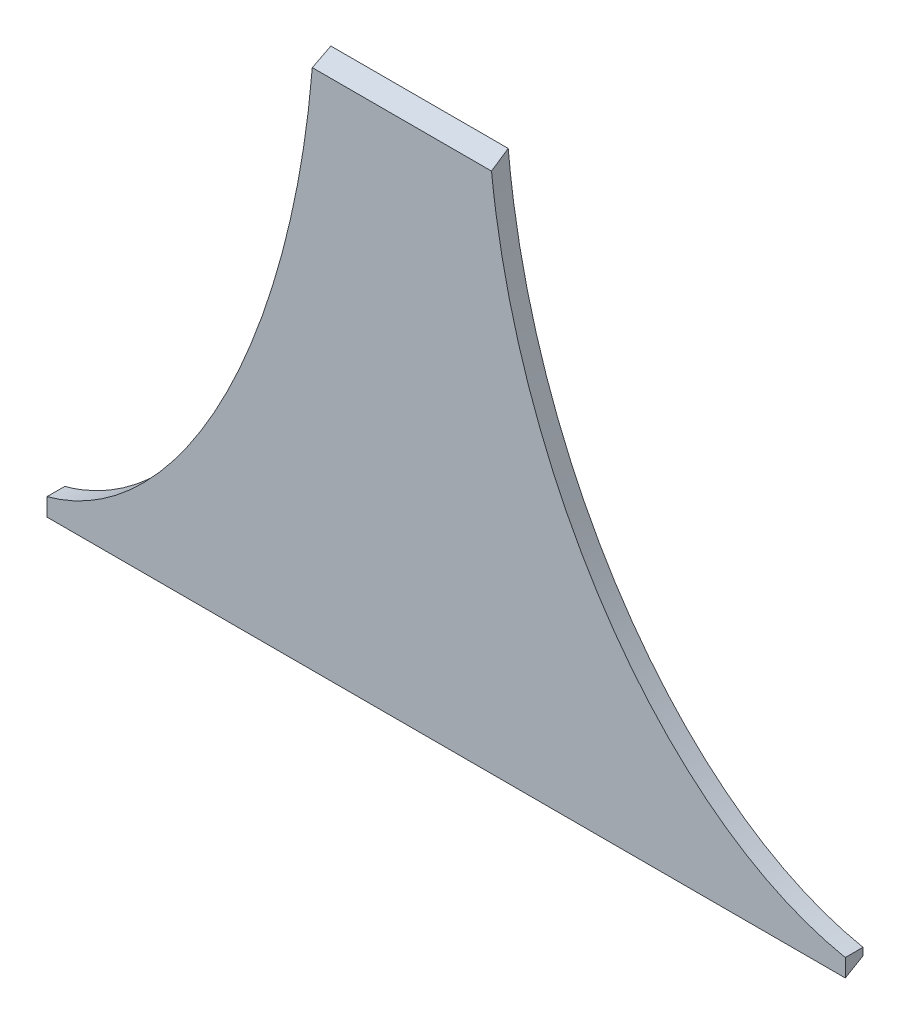
from build123d import *

# Parameters (mm, degrees)
BOSS_EXTRUDE1_DEPTH = 2.54
CUT_EXTRUDE3_REACH  = 139.395
CUT_EXTRUDE4_DEPTH  = 77.978


with BuildPart() as part:
    # Sketch1 → Boss-Extrude1 (new body)
    with BuildSketch(Plane.XY):
        with BuildLine():
            Line((0, 0), (-114.3, 0))
            Line((-114.3, 0), (-114.3, 2.54))
            add(Edge.make_bspline(
                [(-114.3, 2.54), (-80.840252574, 11.511154975), (-76.2, 76.2)],
                knots=[0.188439876, 0.188439876, 0.188439876, 1.620106138, 1.620106138, 1.620106138], degree=2, weights=[1, 0.754546764, 1]))
            Line((-76.2, 76.2), (-50.8, 76.2))
            add(Edge.make_bspline(
                [(-50.8, 76.2), (-44.726222493, 11.346977385), (0, 2.54)],
                knots=[4.596431231, 4.596431231, 4.596431231, 6.031007642, 6.031007642, 6.031007642], degree=2, weights=[1, 0.753591079, 1]))
            Line((0, 2.54), (0, 0))
        make_face()
    extrude(amount=BOSS_EXTRUDE1_DEPTH)

    # Sketch4 → Cut-Extrude3 (cut, up to next)
    with BuildSketch(Plane.ZY.offset(114.3), mode=Mode.PRIVATE) as cut_extrude3_sk1:
        Polygon((2.54, 0), (0, 1.466469684), (0, 0), align=None)
    cut_extrude3_tool1 = extrude(cut_extrude3_sk1.sketch, amount=-CUT_EXTRUDE3_REACH, mode=Mode.PRIVATE) & part.part
    add(cut_extrude3_tool1.solids().sort_by_distance((-114.3, 0.488823, 0.846667))[0], mode=Mode.SUBTRACT)

    # Sketch5 → Cut-Extrude4 (cut)
    with BuildSketch(Plane.ZY.offset(114.3)):
        Polygon((0, 76.2), (2.54, 74.733530316), (2.54, 76.2), align=None)
    extrude(amount=-CUT_EXTRUDE4_DEPTH, mode=Mode.SUBTRACT)


solid = part.part
